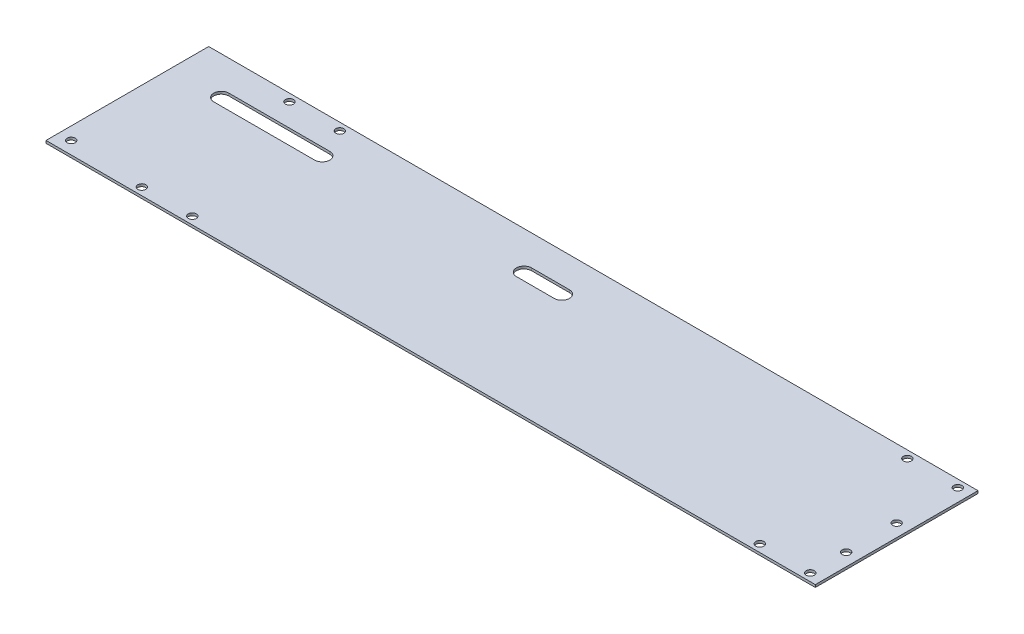
from build123d import *

# Parameters (mm, degrees)
SKETCH_1_W          = 330
SKETCH_1_H          = 64.5
EXTRUDE_1_DEPTH     = 1
SKETCH_2_R          = 1.6
CUT_EXTRUDE_1_DEPTH = 337.245817818
CUT_EXTRUDE_2_REACH = 338.246
SKETCH_3_W          = 25
SKETCH_3_H          = 64.5
CUT_EXTRUDE_3_REACH = 313.747


with BuildPart() as part:
    # 草图1 → 凸台-拉伸1 (new body)
    with BuildSketch(Plane(origin=(0, 0, 0), x_dir=(1, 0, 0), z_dir=(0, 1, 0))):
        with Locations((165, 32.25)):
            Rectangle(SKETCH_1_W, SKETCH_1_H)
    extrude(amount=EXTRUDE_1_DEPTH)

    # 草图2 → 切除-拉伸1 (cut, through all)
    with BuildSketch(Plane(origin=(0, 1, 0), x_dir=(1, 0, 0), z_dir=(0, 1, 0))):
        with Locations(Location((35, 61.5, 0), (0, 0, 270))):
            Circle(SKETCH_2_R)
        with Locations(Location((55, 61.5, 0), (0, 0, 270))):
            Circle(SKETCH_2_R)
        with Locations(Location((280, 61.5, 0), (0, 0, 270))):
            Circle(SKETCH_2_R)
        with Locations(Location((300, 61.5, 0), (0, 0, 270))):
            Circle(SKETCH_2_R)
        with Locations(Location((300, 3, 0), (0, 0, 90))):
            Circle(SKETCH_2_R)
        with Locations(Location((280, 3, 0), (0, 0, 90))):
            Circle(SKETCH_2_R)
        with Locations(Location((55, 3, 0), (0, 0, 90))):
            Circle(SKETCH_2_R)
        with Locations(Location((35, 3, 0), (0, 0, 90))):
            Circle(SKETCH_2_R)
        with Locations(Location((300, 37.25, 0), (0, 0, 90))):
            Circle(SKETCH_2_R)
        with Locations(Location((300, 17.25, 0), (0, 0, 90))):
            Circle(SKETCH_2_R)
        with Locations(Location((5, 5, 0), (0, 0, 270))):
            Circle(SKETCH_2_R)
    extrude(amount=-CUT_EXTRUDE_1_DEPTH, mode=Mode.SUBTRACT)

    # 草图3 → 切除-拉伸2 (cut, up to next)
    with BuildSketch(Plane(origin=(0, 1, 0), x_dir=(1, 0, 0), z_dir=(0, 1, 0)), mode=Mode.PRIVATE) as cut_extrude_2_sk1:
        with Locations((317.5, 32.25)):
            Rectangle(SKETCH_3_W, SKETCH_3_H)
    cut_extrude_2_tool1 = extrude(cut_extrude_2_sk1.sketch, amount=-CUT_EXTRUDE_2_REACH, mode=Mode.PRIVATE) & part.part
    add(cut_extrude_2_tool1.solids().sort_by_distance((317.5, 1, -32.25))[0], mode=Mode.SUBTRACT)

    # 草图4 → 切除-拉伸3 (cut, up to next)
    with BuildSketch(Plane(origin=(0, 1, 0), x_dir=(1, 0, 0), z_dir=(0, 1, 0)), mode=Mode.PRIVATE) as cut_extrude_3_sk1:
        with BuildLine():
            Line((140, 52.5), (155, 52.5))
            ThreePointArc((155, 52.5), (158, 49.5), (155, 46.5))
            Line((155, 46.5), (140, 46.5))
            ThreePointArc((140, 46.5), (137, 49.5), (140, 52.5))
        make_face()
    cut_extrude_3_tool1 = extrude(cut_extrude_3_sk1.sketch, amount=-CUT_EXTRUDE_3_REACH, mode=Mode.PRIVATE) & part.part
    # 草图4 → 切除-拉伸3 (cut, up to next)
    with BuildSketch(Plane(origin=(0, 1, 0), x_dir=(1, 0, 0), z_dir=(0, 1, 0)), mode=Mode.PRIVATE) as cut_extrude_3_sk2:
        with BuildLine():
            Line((20, 52.5), (60, 52.5))
            ThreePointArc((60, 52.5), (63, 49.5), (60, 46.5))
            Line((60, 46.5), (20, 46.5))
            ThreePointArc((20, 46.5), (17, 49.5), (20, 52.5))
        make_face()
    cut_extrude_3_tool2 = extrude(cut_extrude_3_sk2.sketch, amount=-CUT_EXTRUDE_3_REACH, mode=Mode.PRIVATE) & part.part
    add(cut_extrude_3_tool1.solids().sort_by_distance((147.5, 1, -49.5))[0], mode=Mode.SUBTRACT)
    add(cut_extrude_3_tool2.solids().sort_by_distance((40, 1, -49.5))[0], mode=Mode.SUBTRACT)


solid = part.part
